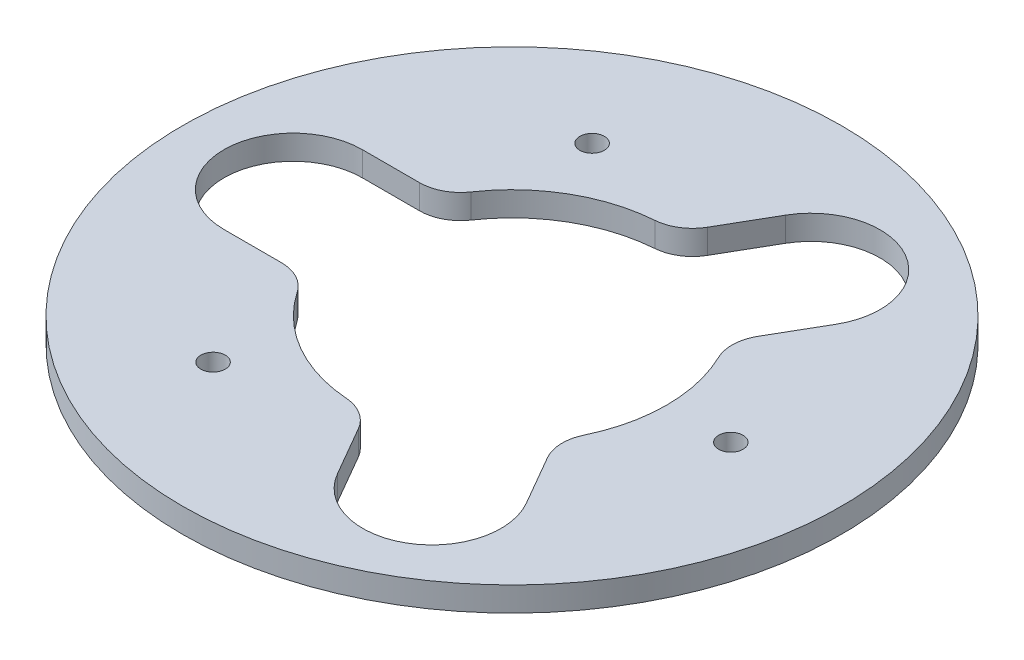
from build123d import *

# Parameters (mm, degrees)
SKETCH1_R           = 40.5
SKETCH1_R_2         = 1.5
BOSS_EXTRUDE1_DEPTH = 3


with BuildPart() as part:
    # Sketch1 → Boss-Extrude1 (new body)
    with BuildSketch(Plane(origin=(0, 0, 0), x_dir=(1, 0, 0), z_dir=(0, 1, 0))):
        with Locations(Location((0, 0, 0), (0, 0, 270))):
            Circle(SKETCH1_R)
        with Locations(Location((-13.447058678, 23.290988922, 0), (0, 0, 270))):
            Circle(SKETCH1_R_2, mode=Mode.SUBTRACT)
        with Locations(Location((26.894117425, -4e-08, 0), (0, 0, 270))):
            Circle(SKETCH1_R_2, mode=Mode.SUBTRACT)
        with Locations(Location((-13.447058747, -23.290988882, 0), (0, 0, 270))):
            Circle(SKETCH1_R_2, mode=Mode.SUBTRACT)
        with BuildLine():
            Line((6.085843699, 27.540990494), (2.560351484, 21.434658856))
            ThreePointArc((2.560351484, 21.434658856), (0.888284255, 19.699718697), (-1.401072298, 18.948271594))
            ThreePointArc((-1.401072298, 18.948271594), (-9.5, 16.454482672), (-15.709148409, 10.6875))
            ThreePointArc((-15.709148409, 10.6875), (-17.504598966, 9.080582618), (-19.843134833, 8.5))
            Line((-19.843134833, 8.5), (-26.894119263, 8.5))
            ThreePointArc((-26.894119263, 8.5), (-35.394119263, 0), (-26.894119263, -8.5))
            Line((-26.894119263, -8.5), (-19.843134833, -8.5))
            ThreePointArc((-19.843134833, -8.5), (-17.504598966, -9.080582618), (-15.709148409, -10.6875))
            ThreePointArc((-15.709148409, -10.6875), (-9.5, -16.454482672), (-1.401072298, -18.948271594))
            ThreePointArc((-1.401072298, -18.948271594), (0.888284255, -19.699718697), (2.560351484, -21.434658856))
            Line((2.560351484, -21.434658856), (6.085843699, -27.540990494))
            ThreePointArc((6.085843699, -27.540990494), (17.697059631, -30.652206426), (20.808275564, -19.040990494))
            Line((20.808275564, -19.040990494), (17.282783349, -12.934658856))
            ThreePointArc((17.282783349, -12.934658856), (16.616314711, -10.619136079), (17.110220708, -8.260771594))
            ThreePointArc((17.110220708, -8.260771594), (19, 0), (17.110220708, 8.260771594))
            ThreePointArc((17.110220708, 8.260771594), (16.616314711, 10.619136079), (17.282783349, 12.934658856))
            Line((17.282783349, 12.934658856), (20.808275564, 19.040990494))
            ThreePointArc((20.808275564, 19.040990494), (17.697059631, 30.652206426), (6.085843699, 27.540990494))
        make_face(mode=Mode.SUBTRACT)
    extrude(amount=-BOSS_EXTRUDE1_DEPTH)


solid = part.part
